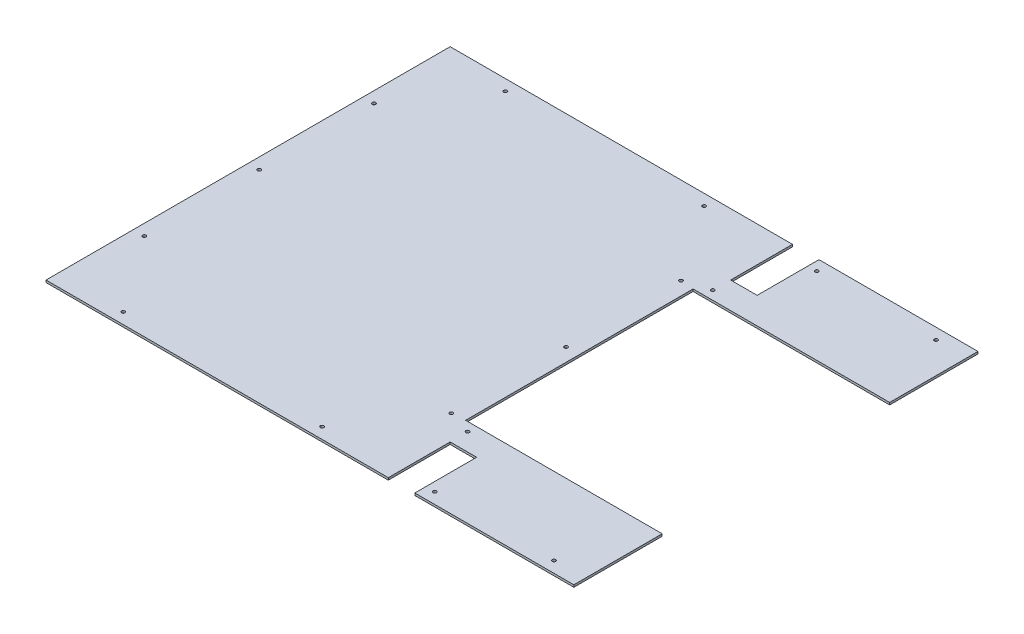
from build123d import *

# Parameters (mm, degrees)
BOSS_EXTRUDE1_DEPTH          = 3.175
F_10_0_1935_DIAMETER_HOLE2_D = 4.9149
SKETCH8_W                    = 38.1
SKETCH8_H                    = 88.9
CUT_EXTRUDE1_DEPTH           = 3.175
F_10_0_1935_DIAMETER_HOLE3_D = 4.9149


with BuildPart() as part:
    # Sketch1 → Boss-Extrude1 (new body)
    with BuildSketch(Plane(origin=(0, 0, 0), x_dir=(1, 0, 0), z_dir=(0, 1, 0))):
        Polygon((476.25, 581.025), (758.825, 581.025), (758.825, 454.025), (476.25, 454.025), (476.25, 127), (758.825, 127), (758.825, 0), (447.675, 0), (0, 0), (0, 581.025), align=None)
    extrude(amount=BOSS_EXTRUDE1_DEPTH)

    # #10 (0.1935) Diameter Hole2 (through all)
    with Locations(Plane(origin=(0, 3.175, 0), x_dir=(1, 0, 0), z_dir=(0, 1, 0))):
        with Locations((15.875, 455.6125), (15.875, 125.4125), (15.875, 290.5125), (381, 565.15), (381, 15.875), (95.25, 565.15), (95.25, 15.875), (457.2, 125.4125), (457.2, 290.5125), (457.2, 455.6125)):
            Hole(F_10_0_1935_DIAMETER_HOLE2_D / 2)

    # Sketch8 → Cut-Extrude1 (cut)
    with BuildSketch(Plane(origin=(0, 3.175, 0), x_dir=(1, 0, 0), z_dir=(0, 1, 0))):
        with Locations((511.175, 44.45)):
            Rectangle(SKETCH8_W, SKETCH8_H)
        with Locations((511.175, 536.575)):
            Rectangle(SKETCH8_W, SKETCH8_H)
    extrude(amount=-CUT_EXTRUDE1_DEPTH, mode=Mode.SUBTRACT)

    # #10 (0.1935) Diameter Hole3 (through all)
    with Locations(Plane(origin=(0, 3.175, 0), x_dir=(1, 0, 0), z_dir=(0, 1, 0))):
        with Locations((491.8075, 114.3), (542.925, 15.875), (714.375, 15.875), (491.8075, 466.725), (542.925, 565.15), (714.375, 565.15)):
            Hole(F_10_0_1935_DIAMETER_HOLE3_D / 2)


solid = part.part
